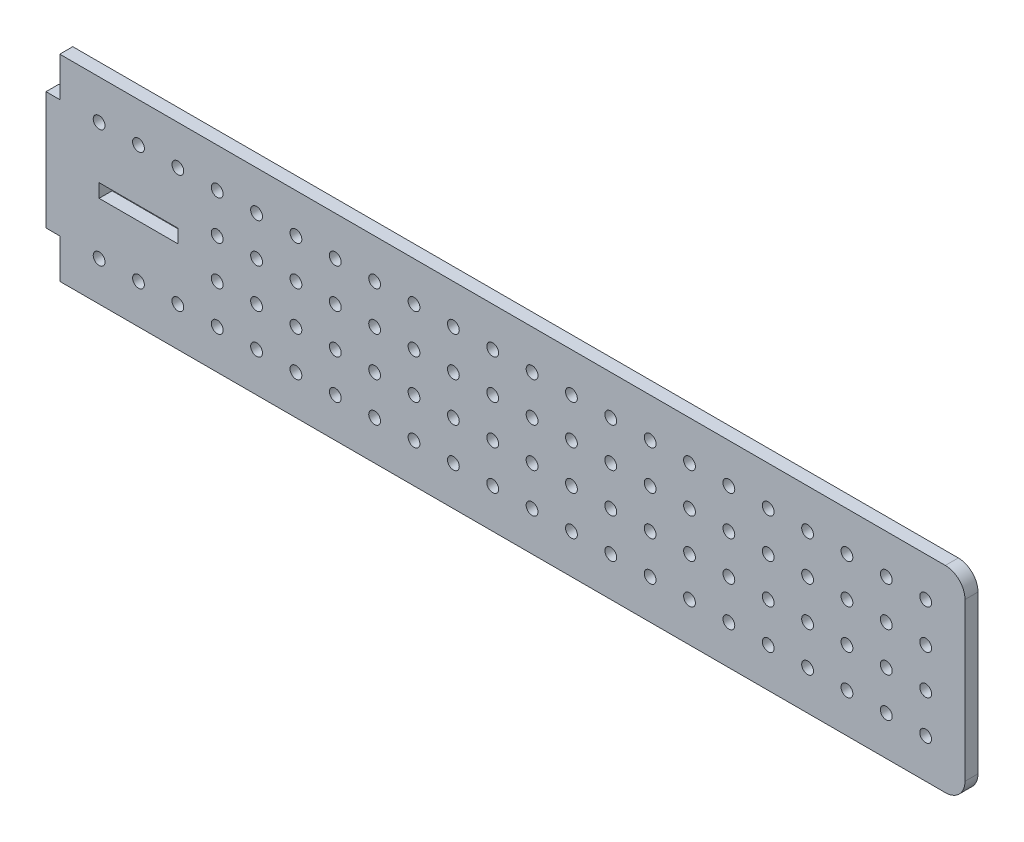
from build123d import *

# Parameters (mm, degrees)
SKETCH1_R           = 1.5
SKETCH1_W           = 20
SKETCH1_H           = 3.45
BOSS_EXTRUDE1_DEPTH = 3.3


with BuildPart() as part:
    # Sketch1 → Boss-Extrude1 (new body)
    with BuildSketch(Plane.XY):
        with BuildLine():
            Line((-115, 25), (110, 25))
            ThreePointArc((110, 25), (113.535533906, 23.535533906), (115, 20))
            Line((115, 20), (115, -20))
            ThreePointArc((115, -20), (113.535533906, -23.535533906), (110, -25))
            Line((110, -25), (-115, -25))
            Line((-115, -25), (-115, -15))
            Line((-115, -15), (-118.5, -15))
            Line((-118.5, -15), (-118.5, 15))
            Line((-118.5, 15), (-115, 15))
            Line((-115, 15), (-115, 25))
        make_face()
        with Locations((-105, -15)):
            Circle(SKETCH1_R, mode=Mode.SUBTRACT)
        with Locations((-95, -15)):
            Circle(SKETCH1_R, mode=Mode.SUBTRACT)
        with Locations((-85, -15)):
            Circle(SKETCH1_R, mode=Mode.SUBTRACT)
        with Locations((-75, -15)):
            Circle(SKETCH1_R, mode=Mode.SUBTRACT)
        with Locations((-65, -15)):
            Circle(SKETCH1_R, mode=Mode.SUBTRACT)
        with Locations((-55, -15)):
            Circle(SKETCH1_R, mode=Mode.SUBTRACT)
        with Locations((-45, -15)):
            Circle(SKETCH1_R, mode=Mode.SUBTRACT)
        with Locations((-35, -15)):
            Circle(SKETCH1_R, mode=Mode.SUBTRACT)
        with Locations((-25, -15)):
            Circle(SKETCH1_R, mode=Mode.SUBTRACT)
        with Locations((-15, -15)):
            Circle(SKETCH1_R, mode=Mode.SUBTRACT)
        with Locations((-5, -15)):
            Circle(SKETCH1_R, mode=Mode.SUBTRACT)
        with Locations((15, -15)):
            Circle(SKETCH1_R, mode=Mode.SUBTRACT)
        with Locations((25, -15)):
            Circle(SKETCH1_R, mode=Mode.SUBTRACT)
        with Locations((5, -15)):
            Circle(SKETCH1_R, mode=Mode.SUBTRACT)
        with Locations((35, -15)):
            Circle(SKETCH1_R, mode=Mode.SUBTRACT)
        with Locations((45, -15)):
            Circle(SKETCH1_R, mode=Mode.SUBTRACT)
        with Locations((55, -15)):
            Circle(SKETCH1_R, mode=Mode.SUBTRACT)
        with Locations((65, -15)):
            Circle(SKETCH1_R, mode=Mode.SUBTRACT)
        with Locations((75, -15)):
            Circle(SKETCH1_R, mode=Mode.SUBTRACT)
        with Locations((85, -15)):
            Circle(SKETCH1_R, mode=Mode.SUBTRACT)
        with Locations((95, -15)):
            Circle(SKETCH1_R, mode=Mode.SUBTRACT)
        with Locations((105, -15)):
            Circle(SKETCH1_R, mode=Mode.SUBTRACT)
        with Locations((-75, -5)):
            Circle(SKETCH1_R, mode=Mode.SUBTRACT)
        with Locations((-65, -5)):
            Circle(SKETCH1_R, mode=Mode.SUBTRACT)
        with Locations((-55, -5)):
            Circle(SKETCH1_R, mode=Mode.SUBTRACT)
        with Locations((-45, -5)):
            Circle(SKETCH1_R, mode=Mode.SUBTRACT)
        with Locations((-35, -5)):
            Circle(SKETCH1_R, mode=Mode.SUBTRACT)
        with Locations((-25, -5)):
            Circle(SKETCH1_R, mode=Mode.SUBTRACT)
        with Locations((-15, -5)):
            Circle(SKETCH1_R, mode=Mode.SUBTRACT)
        with Locations((-5, -5)):
            Circle(SKETCH1_R, mode=Mode.SUBTRACT)
        with Locations((15, -5)):
            Circle(SKETCH1_R, mode=Mode.SUBTRACT)
        with Locations((25, -5)):
            Circle(SKETCH1_R, mode=Mode.SUBTRACT)
        with Locations((5, -5)):
            Circle(SKETCH1_R, mode=Mode.SUBTRACT)
        with Locations((35, -5)):
            Circle(SKETCH1_R, mode=Mode.SUBTRACT)
        with Locations((45, -5)):
            Circle(SKETCH1_R, mode=Mode.SUBTRACT)
        with Locations((55, -5)):
            Circle(SKETCH1_R, mode=Mode.SUBTRACT)
        with Locations((65, -5)):
            Circle(SKETCH1_R, mode=Mode.SUBTRACT)
        with Locations((75, -5)):
            Circle(SKETCH1_R, mode=Mode.SUBTRACT)
        with Locations((85, -5)):
            Circle(SKETCH1_R, mode=Mode.SUBTRACT)
        with Locations((95, -5)):
            Circle(SKETCH1_R, mode=Mode.SUBTRACT)
        with Locations((105, -5)):
            Circle(SKETCH1_R, mode=Mode.SUBTRACT)
        with Locations((-75, 5)):
            Circle(SKETCH1_R, mode=Mode.SUBTRACT)
        with Locations((-65, 5)):
            Circle(SKETCH1_R, mode=Mode.SUBTRACT)
        with Locations((-55, 5)):
            Circle(SKETCH1_R, mode=Mode.SUBTRACT)
        with Locations((-45, 5)):
            Circle(SKETCH1_R, mode=Mode.SUBTRACT)
        with Locations((-35, 5)):
            Circle(SKETCH1_R, mode=Mode.SUBTRACT)
        with Locations((-25, 5)):
            Circle(SKETCH1_R, mode=Mode.SUBTRACT)
        with Locations((-15, 5)):
            Circle(SKETCH1_R, mode=Mode.SUBTRACT)
        with Locations((-5, 5)):
            Circle(SKETCH1_R, mode=Mode.SUBTRACT)
        with Locations((15, 5)):
            Circle(SKETCH1_R, mode=Mode.SUBTRACT)
        with Locations((25, 5)):
            Circle(SKETCH1_R, mode=Mode.SUBTRACT)
        with Locations((5, 5)):
            Circle(SKETCH1_R, mode=Mode.SUBTRACT)
        with Locations((35, 5)):
            Circle(SKETCH1_R, mode=Mode.SUBTRACT)
        with Locations((45, 5)):
            Circle(SKETCH1_R, mode=Mode.SUBTRACT)
        with Locations((55, 5)):
            Circle(SKETCH1_R, mode=Mode.SUBTRACT)
        with Locations((65, 5)):
            Circle(SKETCH1_R, mode=Mode.SUBTRACT)
        with Locations((75, 5)):
            Circle(SKETCH1_R, mode=Mode.SUBTRACT)
        with Locations((85, 5)):
            Circle(SKETCH1_R, mode=Mode.SUBTRACT)
        with Locations((95, 5)):
            Circle(SKETCH1_R, mode=Mode.SUBTRACT)
        with Locations((105, 5)):
            Circle(SKETCH1_R, mode=Mode.SUBTRACT)
        with Locations((-105, 15)):
            Circle(SKETCH1_R, mode=Mode.SUBTRACT)
        with Locations((-95, 15)):
            Circle(SKETCH1_R, mode=Mode.SUBTRACT)
        with Locations((-85, 15)):
            Circle(SKETCH1_R, mode=Mode.SUBTRACT)
        with Locations((-75, 15)):
            Circle(SKETCH1_R, mode=Mode.SUBTRACT)
        with Locations((-65, 15)):
            Circle(SKETCH1_R, mode=Mode.SUBTRACT)
        with Locations((-55, 15)):
            Circle(SKETCH1_R, mode=Mode.SUBTRACT)
        with Locations((-45, 15)):
            Circle(SKETCH1_R, mode=Mode.SUBTRACT)
        with Locations((-35, 15)):
            Circle(SKETCH1_R, mode=Mode.SUBTRACT)
        with Locations((-25, 15)):
            Circle(SKETCH1_R, mode=Mode.SUBTRACT)
        with Locations((-15, 15)):
            Circle(SKETCH1_R, mode=Mode.SUBTRACT)
        with Locations((-5, 15)):
            Circle(SKETCH1_R, mode=Mode.SUBTRACT)
        with Locations((15, 15)):
            Circle(SKETCH1_R, mode=Mode.SUBTRACT)
        with Locations((25, 15)):
            Circle(SKETCH1_R, mode=Mode.SUBTRACT)
        with Locations((5, 15)):
            Circle(SKETCH1_R, mode=Mode.SUBTRACT)
        with Locations((35, 15)):
            Circle(SKETCH1_R, mode=Mode.SUBTRACT)
        with Locations((45, 15)):
            Circle(SKETCH1_R, mode=Mode.SUBTRACT)
        with Locations((55, 15)):
            Circle(SKETCH1_R, mode=Mode.SUBTRACT)
        with Locations((65, 15)):
            Circle(SKETCH1_R, mode=Mode.SUBTRACT)
        with Locations((75, 15)):
            Circle(SKETCH1_R, mode=Mode.SUBTRACT)
        with Locations((85, 15)):
            Circle(SKETCH1_R, mode=Mode.SUBTRACT)
        with Locations((95, 15)):
            Circle(SKETCH1_R, mode=Mode.SUBTRACT)
        with Locations((105, 15)):
            Circle(SKETCH1_R, mode=Mode.SUBTRACT)
        with Locations((-95, 0)):
            Rectangle(SKETCH1_W, SKETCH1_H, mode=Mode.SUBTRACT)
    extrude(amount=BOSS_EXTRUDE1_DEPTH)


solid = part.part
